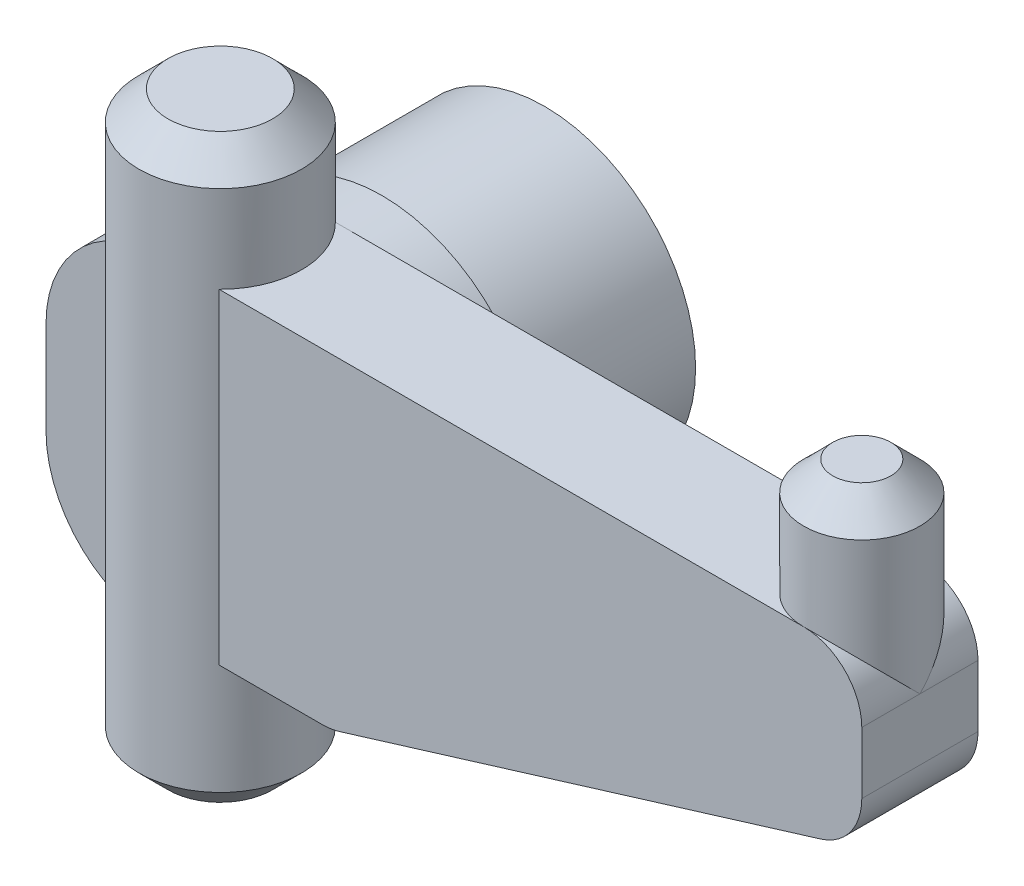
from build123d import *

# Parameters (mm, degrees)
BOSS_EXTRUDE1_DEPTH      = 10
FILLET1_R                = 10
FILLET2_R                = 5
BOSS_EXTRUDE2_DEPTH      = 10
BOSS_EXTRUDE2_DEPTH_BACK = 40
SKETCH2_R                = 7
BOSS_EXTRUDE3_START      = -5
SKETCH3_R                = 5
BOSS_EXTRUDE3_DEPTH      = 15
CHAMFER1_SIZE            = 2.5
BOSS_EXTRUDE4_DEPTH      = 18
BOSS_EXTRUDE4_DEPTH_BACK = 10
SKETCH4_R                = 13
SKETCH5_R                = 13.358898944
BOSS_EXTRUDE5_DEPTH      = 4


with BuildPart() as part:
    # Sketch1 → Boss-Extrude1 (new body)
    with BuildSketch(Plane.XY):
        Polygon((-58.818184361, 21.563458262), (11.382033939, 21.563458262), (11.382033939, 7.563458262), (-34.282866194, -6.436541738), (-58.818184361, -6.436541738), align=None)
    extrude(amount=BOSS_EXTRUDE1_DEPTH)

    # Fillet1
    fillet1_edges = [part.edges().sort_by_distance(p)[0] for p in [
        (-58.818184361, 21.563458262, 5),
        (-58.818184361, -6.436541738, 5),
    ]]
    fillet(fillet1_edges, radius=FILLET1_R)

    # Fillet2
    fillet2_edges = [part.edges().sort_by_distance(p)[0] for p in [
        (11.382033939, 21.563458262, 5),
        (11.382033939, 7.563458262, 5),
        (-34.282866194, -6.436541738, 5),
    ]]
    fillet(fillet2_edges, radius=FILLET2_R)

    # Sketch2 → Boss-Extrude2 (add, two sides: drawn at the far end of the back side and taken through both)
    with BuildSketch(Plane(origin=(0, 21.563458262, 0), x_dir=(1, 0, 0), z_dir=(0, 1, 0)).offset(-BOSS_EXTRUDE2_DEPTH_BACK)):
        with Locations(Location((-48.818184361, -5, 0), (0, 0, 270))):
            Circle(SKETCH2_R)
    extrude(amount=BOSS_EXTRUDE2_DEPTH + BOSS_EXTRUDE2_DEPTH_BACK)

    # Sketch3 → Boss-Extrude3 (add)
    with BuildSketch(Plane(origin=(0, 21.563458262, 0), x_dir=(1, 0, 0), z_dir=(0, 1, 0)).offset(BOSS_EXTRUDE3_START)):
        with Locations(Location((6.382033939, -5, 0), (0, 0, 270))):
            Circle(SKETCH3_R)
    extrude(amount=BOSS_EXTRUDE3_DEPTH)

    # Chamfer1
    chamfer1_edges = [part.edges().sort_by_distance(p)[0] for p in [
        (-48.818184361, -18.436541738, -2),
        (-48.818184361, 31.563458262, -2),
        (6.382033939, 31.563458262, 0),
    ]]
    chamfer(chamfer1_edges, length=CHAMFER1_SIZE)

    # Sketch4 → Boss-Extrude4 (add, two sides: drawn at the far end of the back side and taken through both)
    with BuildSketch(Plane(origin=(0, 0, 0), x_dir=(-1, 0, 0), z_dir=(0, 0, -1)).offset(-BOSS_EXTRUDE4_DEPTH_BACK)):
        with Locations((43.919204876, 8.204559319)):
            Circle(SKETCH4_R)
    extrude(amount=BOSS_EXTRUDE4_DEPTH + BOSS_EXTRUDE4_DEPTH_BACK)

    # Sketch5 → Boss-Extrude5 (add)
    with BuildSketch(Plane(origin=(0, 0, 0), x_dir=(-1, 0, 0), z_dir=(0, 0, -1))):
        with Locations(Location((43.919204876, 8.204559319, 0), (0, 0, 90))):
            Circle(SKETCH5_R)
    extrude(amount=BOSS_EXTRUDE5_DEPTH)


solid = part.part
